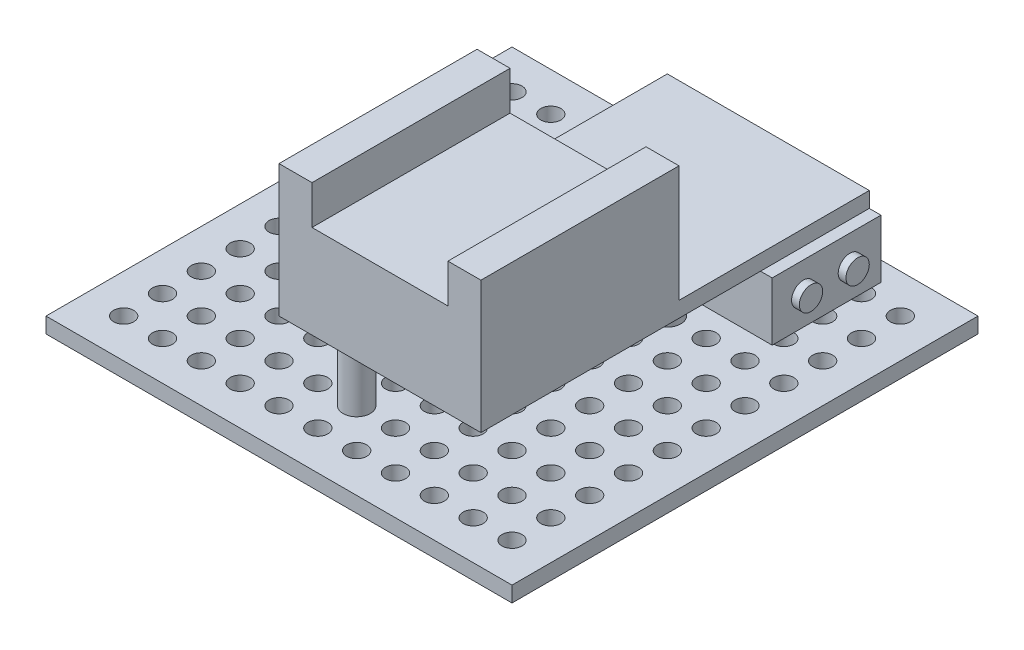
from build123d import *

# Parameters (mm, degrees)
SKETCH1_W                        = 120
SKETCH1_H                        = 120
BOSS_EXTRUDE1_DEPTH              = 4
F_13_64_0_20313_DIAMETER_HOLE1_D = 5.159502
LPATTERN1_COUNT                  = 11
LPATTERN1_PITCH                  = 10
LPATTERN1_COUNT_DIR2             = 11
LPATTERN1_PITCH_DIR2             = 10
SKETCH4_R                        = 3.5
BOSS_EXTRUDE2_DEPTH              = 20
SKETCH5_W                        = 52
SKETCH5_H                        = 100
BOSS_EXTRUDE3_DEPTH              = 4
SKETCH6_W                        = 52
SKETCH6_H                        = 51
BOSS_EXTRUDE4_DEPTH              = 30
SKETCH7_W                        = 35
SKETCH7_H                        = 51
CUT_EXTRUDE1_DEPTH               = 10
SKETCH8_W                        = 35
SKETCH8_H                        = 20
BOSS_EXTRUDE5_DEPTH              = 4
SKETCH9_W                        = 7
SKETCH9_H                        = 7
BOSS_EXTRUDE6_DEPTH              = 2
SKETCH10_W                       = 45
SKETCH10_H                       = 28
BOSS_EXTRUDE7_DEPTH              = 15
SKETCH11_R                       = 3
BOSS_EXTRUDE8_DEPTH              = 2


with BuildPart() as part:
    # Sketch1 → Boss-Extrude1 (new body)
    with BuildSketch(Plane(origin=(0, 0, 0), x_dir=(1, 0, 0), z_dir=(0, 1, 0))):
        Rectangle(SKETCH1_W, SKETCH1_H)
    extrude(amount=BOSS_EXTRUDE1_DEPTH)

    # 13/64 (0.20313) Diameter Hole1 (through all)
    with Locations(Plane(origin=(0, 4, 0), x_dir=(1, 0, 0), z_dir=(0, 1, 0))):
        with Locations((-50, 50)):
            f_13_64_0_20313_diameter_hole1 = Hole(F_13_64_0_20313_DIAMETER_HOLE1_D / 2)

    # LPattern1: 13_64 _0.20313_ Diameter Hole1 11 × 11
    with Locations(*[(j * LPATTERN1_PITCH_DIR2, 0, i * LPATTERN1_PITCH) for i in range(LPATTERN1_COUNT) for j in range(LPATTERN1_COUNT_DIR2) if (i, j) != (0, 0)]):
        add(f_13_64_0_20313_diameter_hole1, mode=Mode.SUBTRACT)

    # Sketch4 → Boss-Extrude2 (add)
    with BuildSketch(Plane(origin=(0, 4, 0), x_dir=(1, 0, 0), z_dir=(0, 1, 0))):
        with Locations(Location((0, -40, 0), (0, 0, 90))):
            Circle(SKETCH4_R)
        with Locations(Location((0, 20, 0), (0, 0, 90))):
            Circle(SKETCH4_R)
        with Locations(Location((20, 20, 0), (0, 0, 90))):
            Circle(SKETCH4_R)
    extrude(amount=BOSS_EXTRUDE2_DEPTH)

    # Sketch5 → Boss-Extrude3 (add)
    with BuildSketch(Plane(origin=(0, 24, 0), x_dir=(1, 0, 0), z_dir=(0, 1, 0))):
        with Locations((16, 0)):
            Rectangle(SKETCH5_W, SKETCH5_H)
    extrude(amount=BOSS_EXTRUDE3_DEPTH)

    # Sketch6 → Boss-Extrude4 (add)
    with BuildSketch(Plane(origin=(0, 28, 0), x_dir=(1, 0, 0), z_dir=(0, 1, 0))):
        with Locations((16, -24.5)):
            Rectangle(SKETCH6_W, SKETCH6_H)
    extrude(amount=BOSS_EXTRUDE4_DEPTH)

    # Sketch7 → Cut-Extrude1 (cut)
    with BuildSketch(Plane(origin=(0, 58, 0), x_dir=(1, 0, 0), z_dir=(0, 1, 0))):
        with Locations((16, -24.5)):
            Rectangle(SKETCH7_W, SKETCH7_H)
    extrude(amount=-CUT_EXTRUDE1_DEPTH, mode=Mode.SUBTRACT)

    # Sketch8 → Boss-Extrude5 (add)
    with BuildSketch(Plane(origin=(0, 4, 0), x_dir=(1, 0, 0), z_dir=(0, 1, 0))):
        with Locations((-12.5, 0)):
            Rectangle(SKETCH8_W, SKETCH8_H)
    extrude(amount=BOSS_EXTRUDE5_DEPTH)

    # Sketch9 → Boss-Extrude6 (add)
    with BuildSketch(Plane(origin=(0, 8, 0), x_dir=(1, 0, 0), z_dir=(0, 1, 0))):
        Rectangle(SKETCH9_W, SKETCH9_H)
    extrude(amount=BOSS_EXTRUDE6_DEPTH)

    # Sketch10 → Boss-Extrude7 (add)
    with BuildSketch(Plane(origin=(0, 4, 0), x_dir=(1, 0, 0), z_dir=(0, 1, 0))):
        with Locations((17.5, 41)):
            Rectangle(SKETCH10_W, SKETCH10_H)
    extrude(amount=BOSS_EXTRUDE7_DEPTH)

    # Sketch11 → Boss-Extrude8 (add)
    with BuildSketch(Plane(origin=(40, 0, 0), x_dir=(0, 0, -1), z_dir=(1, 0, 0))):
        with Locations(Location((35, 11.5, 0), (0, 0, 180))):
            Circle(SKETCH11_R)
        with Locations(Location((47, 11.5, 0), (0, 0, 180))):
            Circle(SKETCH11_R)
    extrude(amount=BOSS_EXTRUDE8_DEPTH)


solid = part.part
